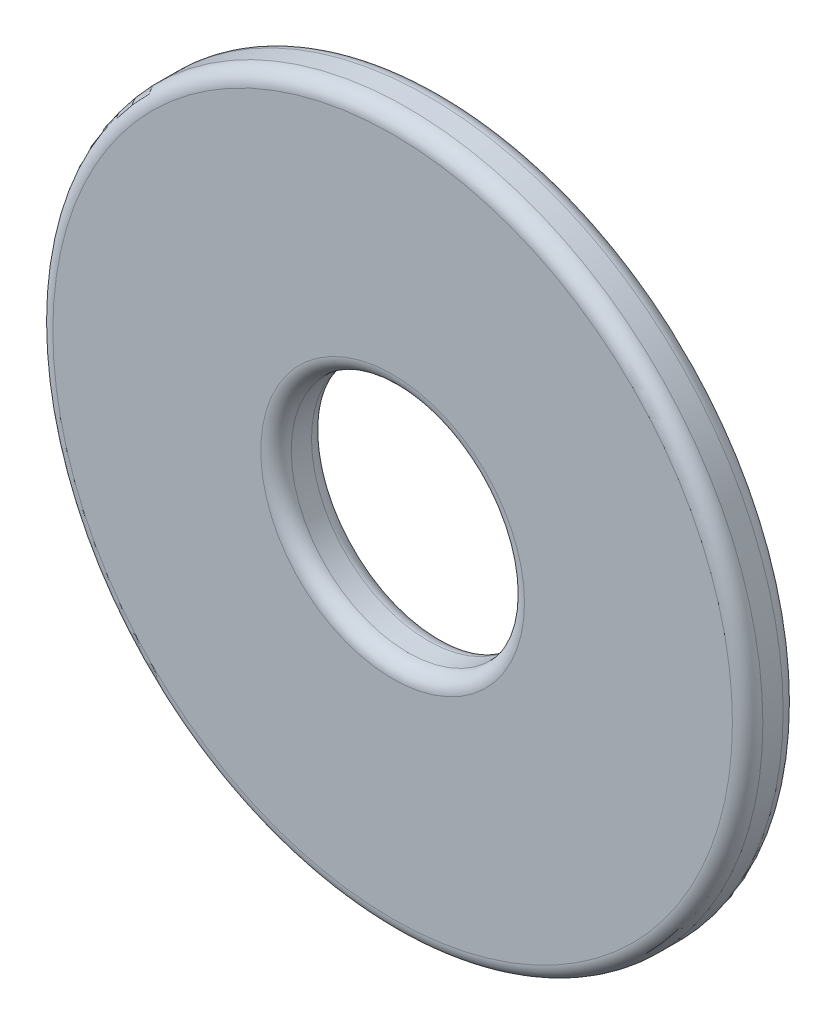
from build123d import *

# Parameters (mm, degrees)
SKETCH1_R      = 3.5
SKETCH1_R_2    = 1.15
EXTRUDE1_DEPTH = 0.25
FILLET1_R      = 0.15


with BuildPart() as part:
    # Sketch1 → Extrude1 (new, symmetric)
    with BuildSketch(Plane.XY):
        Circle(SKETCH1_R)
        Circle(SKETCH1_R_2, mode=Mode.SUBTRACT)
    extrude(amount=EXTRUDE1_DEPTH, both=True)

    # Fillet1
    fillet1_edges = [part.edges().sort_by_distance(p)[0] for p in [
        (-3.5, 0, -0.25),
        (-3.5, 0, 0.25),
        (-1.15, 0, -0.25),
        (-1.15, 0, 0.25),
    ]]
    fillet(fillet1_edges, radius=FILLET1_R)


solid = part.part
